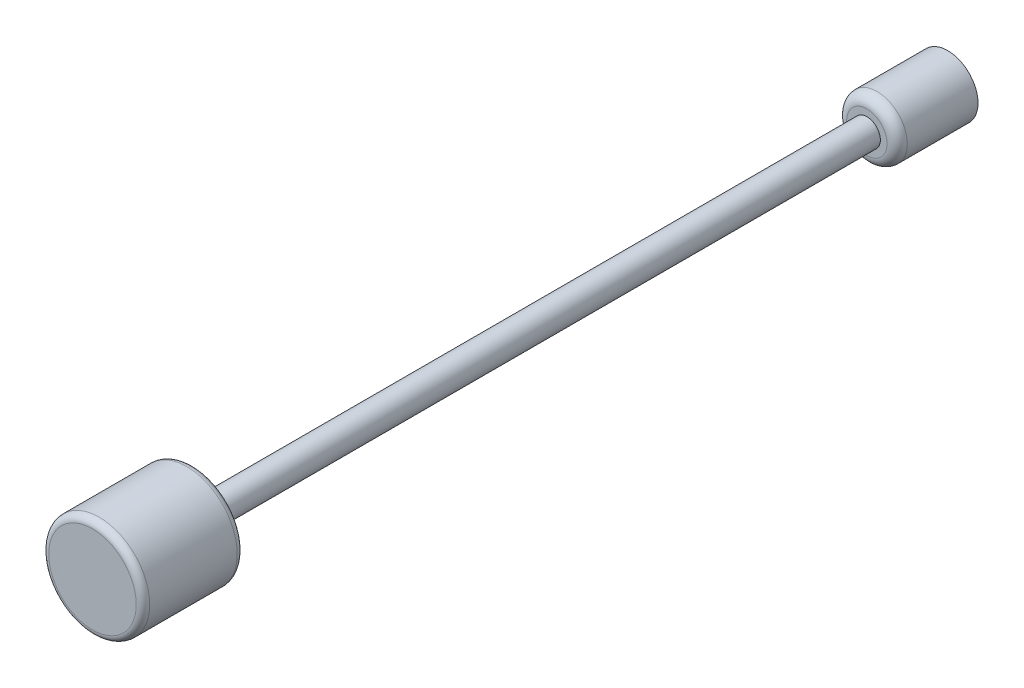
from build123d import *

# Parameters (mm, degrees)
SKETCH1_R           = 4.5
SKETCH1_R_2         = 3
BOSS_EXTRUDE1_DEPTH = 10
SKETCH2_R           = 4.5
BOSS_EXTRUDE2_DEPTH = 2
SKETCH3_R           = 2
BOSS_EXTRUDE3_DEPTH = 100
SKETCH4_R           = 7.5
BOSS_EXTRUDE4_DEPTH = 15
FILLET1_R           = 1
FILLET2_R           = 1.5


with BuildPart() as part:
    # Sketch1 → Boss-Extrude1 (new body)
    with BuildSketch(Plane.XY):
        with Locations((1107.950719415, 105.911007762)):
            Circle(SKETCH1_R)
        with Locations((1107.950719415, 105.911007762)):
            Circle(SKETCH1_R_2, mode=Mode.SUBTRACT)
    extrude(amount=BOSS_EXTRUDE1_DEPTH)

    # Sketch2 → Boss-Extrude2 (add)
    with BuildSketch(Plane.XY.offset(10)):
        with Locations((1107.950719415, 105.911007762)):
            Circle(SKETCH2_R)
    extrude(amount=BOSS_EXTRUDE2_DEPTH)

    # Sketch3 → Boss-Extrude3 (add)
    with BuildSketch(Plane.XY.offset(12)):
        with Locations((1107.950719415, 105.911007762)):
            Circle(SKETCH3_R)
    extrude(amount=BOSS_EXTRUDE3_DEPTH)

    # Sketch4 → Boss-Extrude4 (add)
    with BuildSketch(Plane.XY.offset(112)):
        with Locations((1107.950719415, 105.911007762)):
            Circle(SKETCH4_R)
    extrude(amount=BOSS_EXTRUDE4_DEPTH)

    # Fillet1
    fillet1_edges = [part.edges().sort_by_distance(p)[0] for p in [
        (1100.450719415, 105.911007762, 112),
        (1100.450719415, 105.911007762, 127),
    ]]
    fillet(fillet1_edges, radius=FILLET1_R)

    # Fillet2
    fillet2_edges = [part.edges().sort_by_distance(p)[0] for p in [
        (1103.450719415, 105.911007762, 12),
    ]]
    fillet(fillet2_edges, radius=FILLET2_R)


solid = part.part
